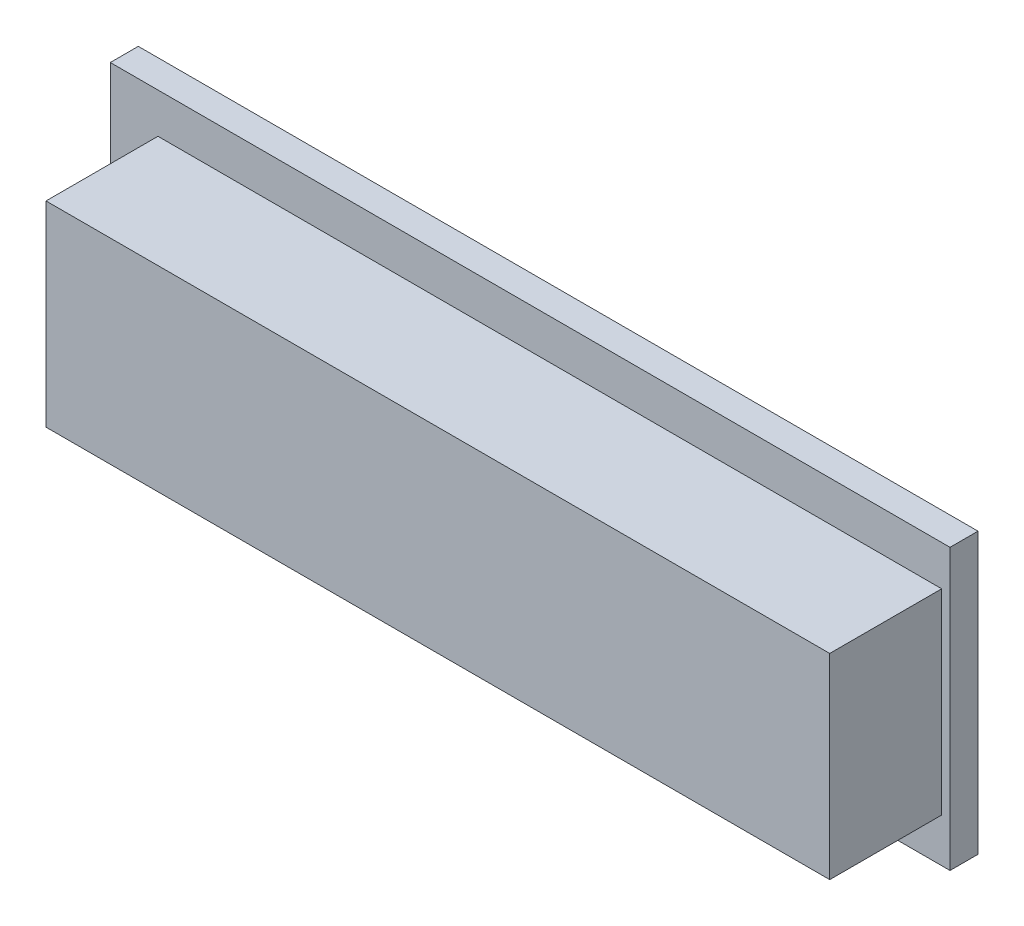
from build123d import *

# Parameters (mm, degrees)
SKETCH_1_W          = 30
SKETCH_1_H          = 10
EXTRUDE_1_DEPTH     = 5
SKETCH_2_W          = 6.2
SKETCH_2_H          = 6
CUT_EXTRUDE_1_DEPTH = 2
SKETCH_3_R          = 1.5
CUT_EXTRUDE_4_DEPTH = 2
SKETCH_5_W          = 30
SKETCH_5_H          = 10
SKETCH_5_W_2        = 28
SKETCH_5_H_2        = 7
CUT_EXTRUDE_5_DEPTH = 4


with BuildPart() as part:
    # 草图1 → 凸台-拉伸1 (new body)
    with BuildSketch(Plane.XY):
        with Locations((-25.027311994, -7.227757648)):
            Rectangle(SKETCH_1_W, SKETCH_1_H)
    extrude(amount=EXTRUDE_1_DEPTH)

    # 草图2 → 切除-拉伸1 (cut)
    with BuildSketch(Plane(origin=(0, 0, 0), x_dir=(-1, 0, 0), z_dir=(0, 0, -1))):
        with Locations((21.488967254, -7.159562762)):
            Rectangle(SKETCH_2_W, SKETCH_2_H)
        with Locations((14.688967254, -7.159562762)):
            Rectangle(SKETCH_2_W, SKETCH_2_H)
        with Locations((28.288967254, -7.159562762)):
            Rectangle(SKETCH_2_W, SKETCH_2_H)
        with Locations((35.088967254, -7.159562762)):
            Rectangle(SKETCH_2_W, SKETCH_2_H)
    extrude(amount=-CUT_EXTRUDE_1_DEPTH, mode=Mode.SUBTRACT)

    # 草图3 → 切除-拉伸4 (cut)
    with BuildSketch(Plane(origin=(0, 0, 2), x_dir=(-1, 0, 0), z_dir=(0, 0, -1))):
        with Locations((14.688967254, -7.159562762)):
            Circle(SKETCH_3_R)
        with Locations((21.488967254, -7.159562762)):
            Circle(SKETCH_3_R)
        with Locations((28.288967254, -7.159562762)):
            Circle(SKETCH_3_R)
        with Locations((35.088967254, -7.159562762)):
            Circle(SKETCH_3_R)
    extrude(amount=-CUT_EXTRUDE_4_DEPTH, mode=Mode.SUBTRACT)

    # 草图5 → 切除-拉伸5 (cut)
    with BuildSketch(Plane.XY.offset(5)):
        with Locations((-25.027311994, -7.227757648)):
            Rectangle(SKETCH_5_W, SKETCH_5_H)
        with Locations((-24.3244943, -7.159562762)):
            Rectangle(SKETCH_5_W_2, SKETCH_5_H_2, mode=Mode.SUBTRACT)
    extrude(amount=-CUT_EXTRUDE_5_DEPTH, mode=Mode.SUBTRACT)


solid = part.part
